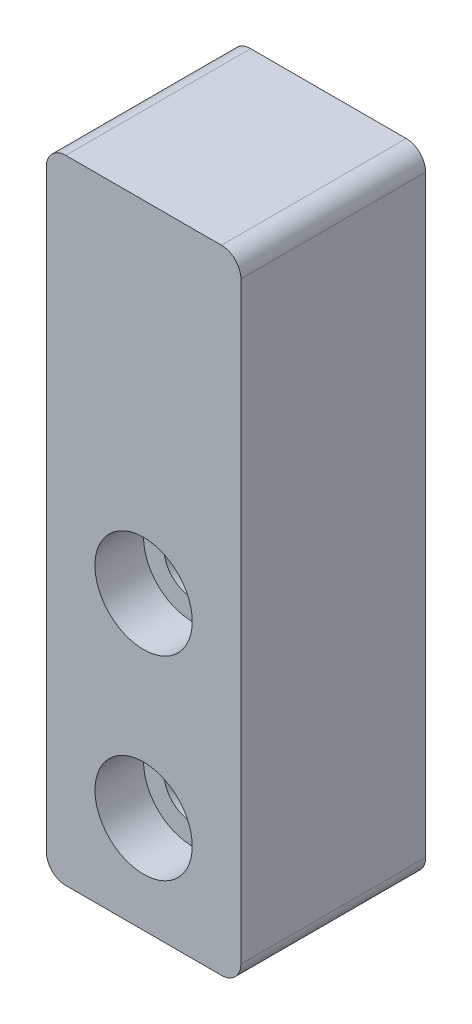
from build123d import *

# Parameters (mm, degrees)
SKETCH1_W                      = 20
SKETCH1_H                      = 65
BOSS_EXTRUDE1_DEPTH            = 19
CBORE_FOR_M5_SHCS1_D           = 5.8
CBORE_FOR_M5_SHCS1_CBORE_D     = 10
CBORE_FOR_M5_SHCS1_CBORE_DEPTH = 5
FILLET1_R                      = 2


with BuildPart() as part:
    # Sketch1 → Boss-Extrude1 (new body)
    with BuildSketch(Plane.XY):
        Rectangle(SKETCH1_W, SKETCH1_H)
    extrude(amount=BOSS_EXTRUDE1_DEPTH)

    # CBORE for M5 SHCS1 (through all)
    with Locations(Plane.XY.offset(19)):
        with Locations((0, -2.5), (0, -22.5)):
            CounterBoreHole(CBORE_FOR_M5_SHCS1_D / 2, CBORE_FOR_M5_SHCS1_CBORE_D / 2, CBORE_FOR_M5_SHCS1_CBORE_DEPTH)

    # Fillet1
    fillet1_edges = [part.edges().sort_by_distance(p)[0] for p in [
        (10, -32.5, 9.5),
        (-10, -32.5, 9.5),
        (-10, 32.5, 9.5),
        (10, 32.5, 9.5),
    ]]
    fillet(fillet1_edges, radius=FILLET1_R)


solid = part.part
